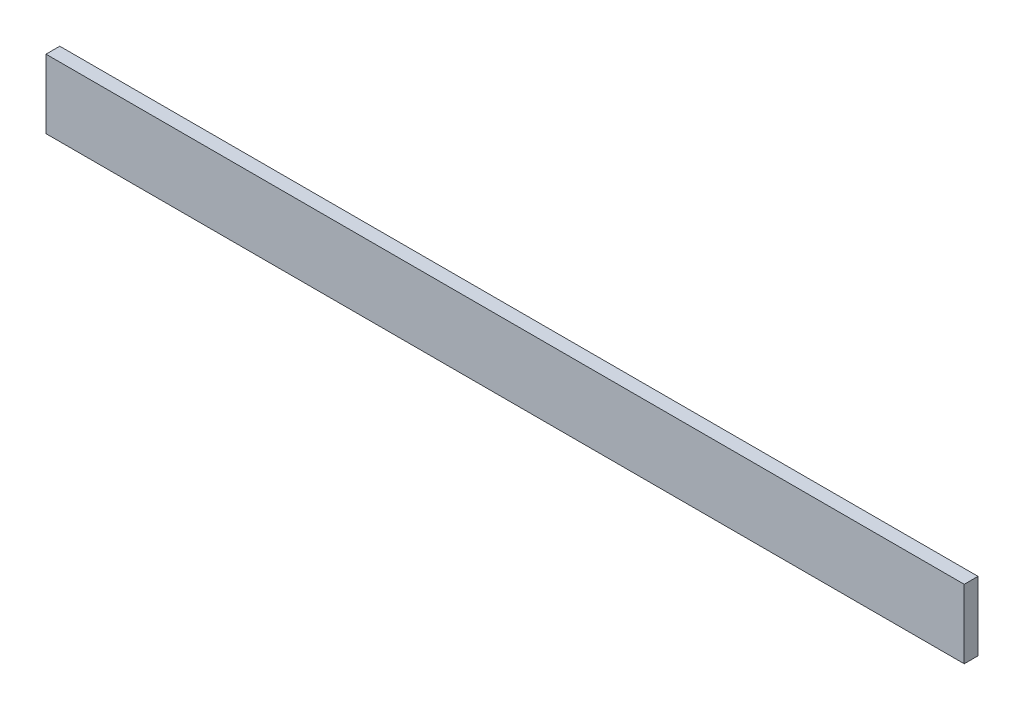
from build123d import *

# Parameters (mm, degrees)
SKETCH1_W           = 100
SKETCH1_H           = 7.5
BOSS_EXTRUDE1_DEPTH = 1.5
SCALE1_SCALE        = 10


with BuildPart() as part:
    # Sketch1 → Boss-Extrude1 (new body)
    with BuildSketch(Plane.XY):
        with Locations((50, 3.75)):
            Rectangle(SKETCH1_W, SKETCH1_H)
    extrude(amount=BOSS_EXTRUDE1_DEPTH)


with BuildPart() as part_1:
    # Scale1: scaled about (0, 0, 0)
    add(part.part.scale(SCALE1_SCALE))


solid = part_1.part
